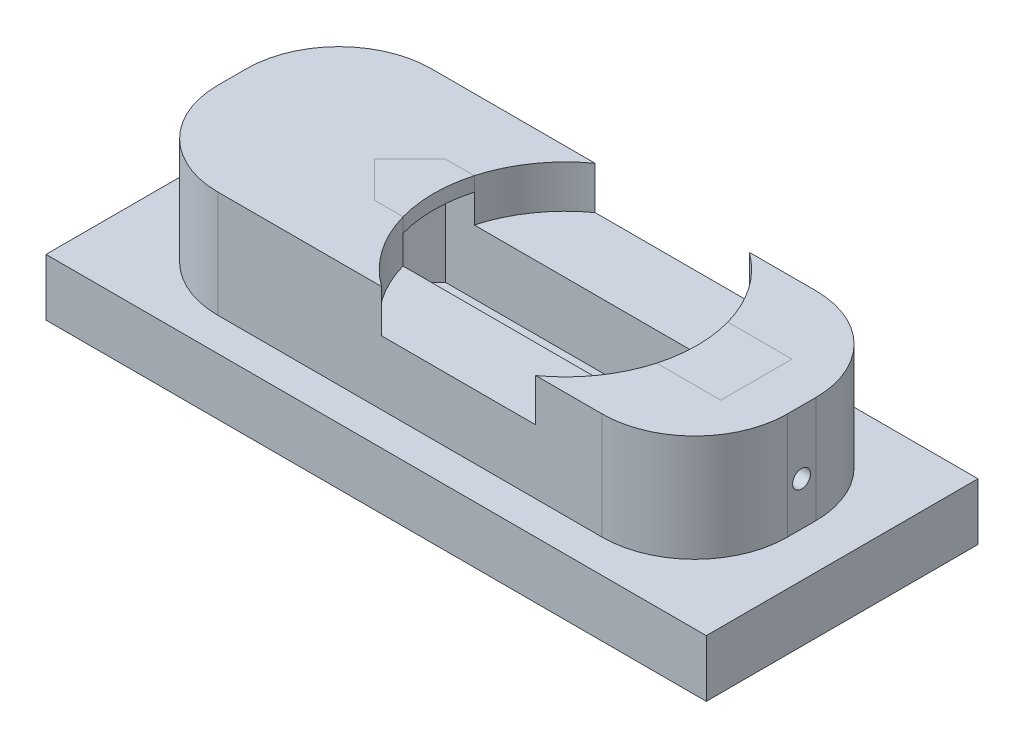
from build123d import *

# Parameters (mm, degrees)
SKETCH1_W                = 80
SKETCH1_H                = 30
BOSS_EXTRUDE1_DEPTH      = 60
CUT_EXTRUDE1_DEPTH       = 75
CUT_EXTRUDE2_DEPTH       = 102.118742081
CUT_EXTRUDE2_DEPTH_BACK  = 102.118742081
SKETCH3_R                = 1.25
FILLET1_R                = 13
SKETCH15_W               = 83.696095513
SKETCH15_H               = 31.69844841
CUT_EXTRUDE7_DEPTH       = 50
BOSS_EXTRUDE4_DEPTH      = 3
BOSS_EXTRUDE4_DEPTH_BACK = 5
SKETCH16_W               = 92.769089126
SKETCH16_H               = 38.173794917
SKETCH18_R               = 18.5
CUT_EXTRUDE8_DEPTH       = 6
BOSS_EXTRUDE5_DEPTH      = 2
BOSS_EXTRUDE5_2_DEPTH    = 2


with BuildPart() as part:
    # Sketch1 → Boss-Extrude1 (new body)
    with BuildSketch(Plane(origin=(0, 0, 0), x_dir=(1, 0, 0), z_dir=(0, 1, 0))):
        Rectangle(SKETCH1_W, SKETCH1_H)
    extrude(amount=BOSS_EXTRUDE1_DEPTH)

    # Sketch2 → Cut-Extrude1 (cut)
    with BuildSketch(Plane(origin=(0, 60, 0), x_dir=(1, 0, 0), z_dir=(0, 1, 0))):
        Polygon((-15, 5), (15, 5), (33.657016573, 5), (33.657016573, -5), (15, -5), (-15, -5), (-20, 0), align=None)
    extrude(amount=-CUT_EXTRUDE1_DEPTH, mode=Mode.SUBTRACT)

    # Sketch3 → Cut-Extrude2 (cut, two sides: drawn at the far end of the back side and taken through both)
    with BuildSketch(Plane.ZY.offset(40).offset(-CUT_EXTRUDE2_DEPTH_BACK)):
        with Locations(Location((0, 51.111959895, 0), (0, 0, 270))):
            Circle(SKETCH3_R)
    extrude(amount=CUT_EXTRUDE2_DEPTH + CUT_EXTRUDE2_DEPTH_BACK, mode=Mode.SUBTRACT)

    # Fillet1
    fillet1_edges = [part.edges().sort_by_distance(p)[0] for p in [
        (40, 30, 15),
        (-40, 30, 15),
        (-40, 30, -15),
        (40, 30, -15),
    ]]
    fillet(fillet1_edges, radius=FILLET1_R)

    # Sketch15 → Cut-Extrude7 (cut)
    with BuildSketch(Plane(origin=(0, -10, 0), x_dir=(-1, 0, 0), z_dir=(0, -1, 0))):
        with Locations((-0.057440767, 0.030479277)):
            Rectangle(SKETCH15_W, SKETCH15_H)
    extrude(amount=-CUT_EXTRUDE7_DEPTH, mode=Mode.SUBTRACT)

    # Sketch16 → Boss-Extrude4 (add, two sides: drawn at the far end of the back side and taken through both)
    with BuildSketch(Plane(origin=(0, 40, 0), x_dir=(-1, 0, 0), z_dir=(0, -1, 0)).offset(-BOSS_EXTRUDE4_DEPTH_BACK)):
        with Locations((0.103396131, -0.575928298)):
            Rectangle(SKETCH16_W, SKETCH16_H)
    extrude(amount=BOSS_EXTRUDE4_DEPTH + BOSS_EXTRUDE4_DEPTH_BACK)

    # Sketch18 → Cut-Extrude8 (cut)
    with BuildSketch(Plane(origin=(0, 60, 0), x_dir=(1, 0, 0), z_dir=(0, 1, 0))):
        with Locations((6.828508286, 0)):
            Circle(SKETCH18_R)
    extrude(amount=-CUT_EXTRUDE8_DEPTH, mode=Mode.SUBTRACT)


with BuildPart() as body_2:
    # Sketch19 → Boss-Extrude5 (new body)
    with BuildSketch(Plane(origin=(0, 60, 0), x_dir=(1, 0, 0), z_dir=(0, 1, 0))):
        with BuildLine():
            Line((-10.983004844, 5), (-15, 5))
            Line((-15, 5), (-20, 0))
            Line((-20, 0), (-15, -5))
            Line((-15, -5), (-10.983004844, -5))
            ThreePointArc((-10.983004844, -5), (-11.671491714, 0), (-10.983004844, 5))
        make_face()
    extrude(amount=-BOSS_EXTRUDE5_DEPTH)


with BuildPart() as body_3:
    # Sketch19 → Boss-Extrude5 2 (new body)
    with BuildSketch(Plane(origin=(0, 60, 0), x_dir=(1, 0, 0), z_dir=(0, 1, 0))):
        with BuildLine():
            Line((24.640021417, 5), (33.657016573, 5))
            Line((33.657016573, 5), (33.657016573, -5))
            Line((33.657016573, -5), (24.640021417, -5))
            ThreePointArc((24.640021417, -5), (25.328508286, 0), (24.640021417, 5))
        make_face()
    extrude(amount=-BOSS_EXTRUDE5_2_DEPTH)


solid = Compound([part.part, body_2.part, body_3.part])
